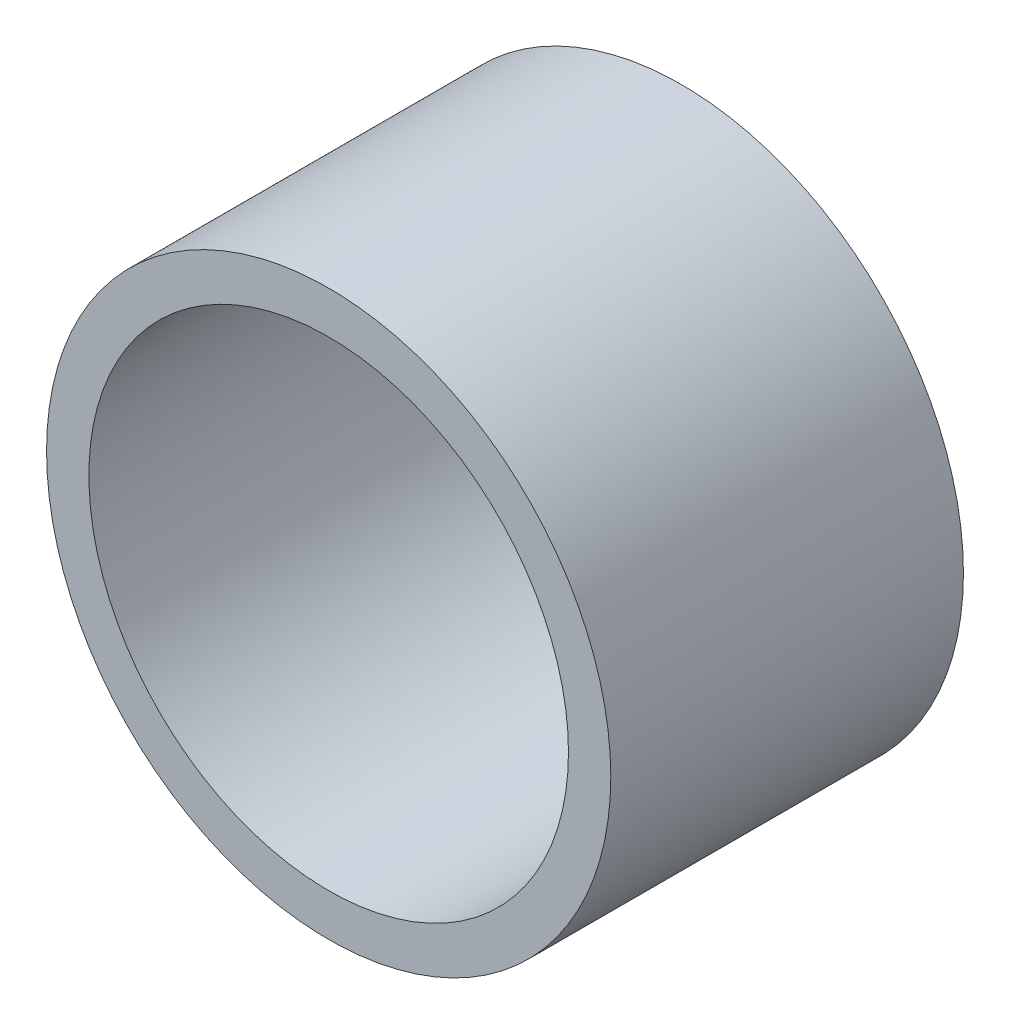
from build123d import *

# Parameters (mm, degrees)
SKETCH1_R           = 6
SKETCH1_R_2         = 5.1
BOSS_EXTRUDE1_DEPTH = 7.5


with BuildPart() as part:
    # Sketch1 → Boss-Extrude1 (new body)
    with BuildSketch(Plane.XY):
        Circle(SKETCH1_R)
        Circle(SKETCH1_R_2, mode=Mode.SUBTRACT)
    extrude(amount=BOSS_EXTRUDE1_DEPTH)


solid = part.part
